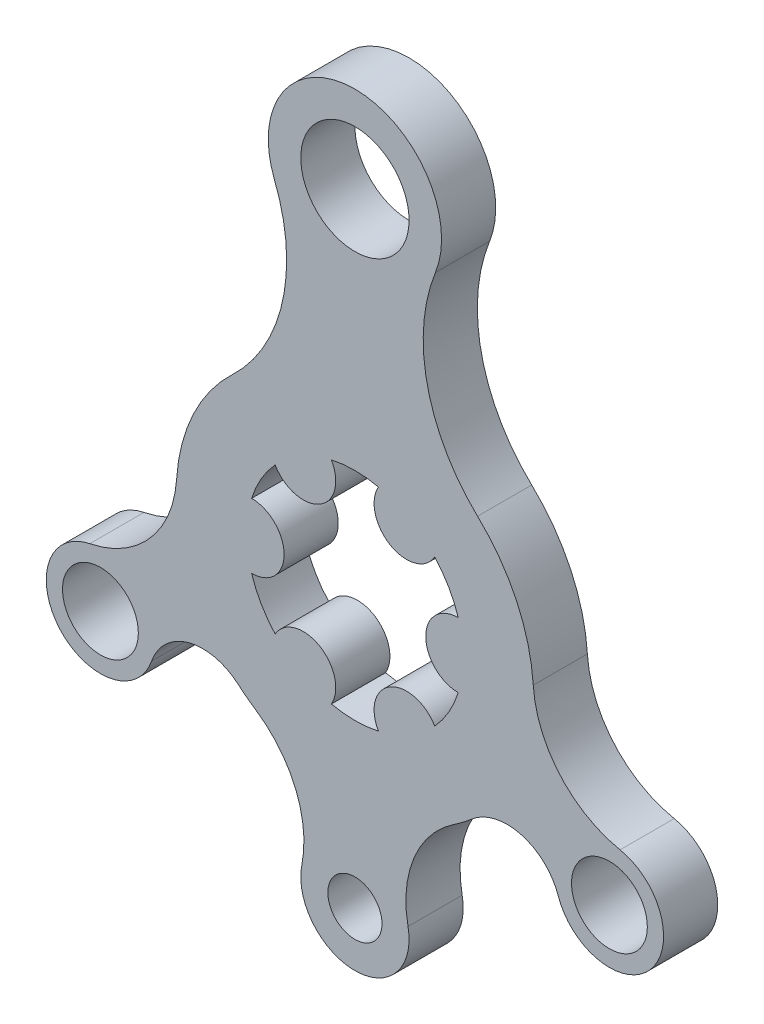
from build123d import *

# Parameters (mm, degrees)
SKETCH1_R           = 7
SKETCH1_R_2         = 5
SKETCH1_R_3         = 10
BOSS_EXTRUDE1_DEPTH = 10


with BuildPart() as part:
    # Sketch1 → Boss-Extrude1 (new body)
    with BuildSketch(Plane.XY):
        with BuildLine():
            ThreePointArc((-14.869403875, 59.092307692), (-13.366464174, 40.352096999), (-22.647245902, 24.002130178))
            ThreePointArc((-22.647245902, 24.002130178), (-29.864288772, 14.040094593), (-32.931378534, 2.127042038))
            ThreePointArc((-32.931378534, 2.127042038), (-37.838433301, -9.754136505), (-48.963263256, -16.194613858))
            ThreePointArc((-48.963263256, -16.194613858), (-54.534765397, -32.574747935), (-37.550915036, -29.273345896))
            ThreePointArc((-37.550915036, -29.273345896), (-30.697148757, -22.889346352), (-21.566520754, -24.9776937))
            ThreePointArc((-21.566520754, -24.9776937), (-19.978209416, -26.265398313), (-18.313197236, -27.452264151))
            ThreePointArc((-18.313197236, -27.452264151), (-10.929939867, -36.447383635), (-9.804034884, -48.03))
            ThreePointArc((-9.804034884, -48.03), (0, -60), (9.804034884, -48.03))
            ThreePointArc((9.804034884, -48.03), (10.929939867, -36.447383635), (18.313197236, -27.452264151))
            ThreePointArc((18.313197236, -27.452264151), (19.978209416, -26.265398313), (21.566520754, -24.9776937))
            ThreePointArc((21.566520754, -24.9776937), (30.697148757, -22.889346352), (37.550915036, -29.273345896))
            ThreePointArc((37.550915036, -29.273345896), (54.534765397, -32.574747935), (48.963263256, -16.194613858))
            ThreePointArc((48.963263256, -16.194613858), (37.838433301, -9.754136505), (32.931378534, 2.127042038))
            ThreePointArc((32.931378534, 2.127042038), (29.864288772, 14.040094593), (22.647245902, 24.002130178))
            ThreePointArc((22.647245902, 24.002130178), (13.366464174, 40.352096999), (14.869403875, 59.092307692))
            ThreePointArc((14.869403875, 59.092307692), (0, 81), (-14.869403875, 59.092307692))
        make_face()
        with Locations((-47, -26)):
            Circle(SKETCH1_R, mode=Mode.SUBTRACT)
        with Locations((0, -50)):
            Circle(SKETCH1_R_2, mode=Mode.SUBTRACT)
        with Locations((47, -26)):
            Circle(SKETCH1_R, mode=Mode.SUBTRACT)
        with BuildLine():
            ThreePointArc((-14.735544437, -13.522711642), (-17.320508076, -10), (-19.078784028, -6))
            ThreePointArc((-19.078784028, -6), (-13.078784028, 0), (-19.078784028, 6))
            ThreePointArc((-19.078784028, 6), (-17.320508076, 10), (-14.735544437, 13.522711642))
            ThreePointArc((-14.735544437, 13.522711642), (-6.539392014, 11.326559219), (-4.343239591, 19.522711642))
            ThreePointArc((-4.343239591, 19.522711642), (0, 20), (4.343239591, 19.522711642))
            ThreePointArc((4.343239591, 19.522711642), (6.539392014, 11.326559219), (14.735544437, 13.522711642))
            ThreePointArc((14.735544437, 13.522711642), (17.320508076, 10), (19.078784028, 6))
            ThreePointArc((19.078784028, 6), (13.078784028, 0), (19.078784028, -6))
            ThreePointArc((19.078784028, -6), (17.320508076, -10), (14.735544437, -13.522711642))
            ThreePointArc((14.735544437, -13.522711642), (6.539392014, -11.326559219), (4.343239591, -19.522711642))
            ThreePointArc((4.343239591, -19.522711642), (0, -20), (-4.343239591, -19.522711642))
            ThreePointArc((-4.343239591, -19.522711642), (-6.539392014, -11.326559219), (-14.735544437, -13.522711642))
        make_face(mode=Mode.SUBTRACT)
        with Locations((0, 65)):
            Circle(SKETCH1_R_3, mode=Mode.SUBTRACT)
    extrude(amount=BOSS_EXTRUDE1_DEPTH)


solid = part.part
